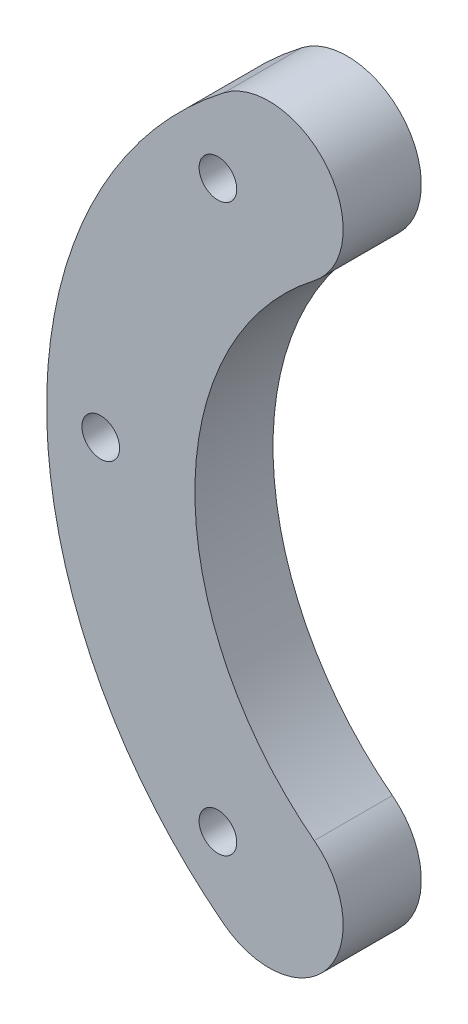
from build123d import *

# Parameters (mm, degrees)
SKETCH_1_R          = 48.25
SKETCH_1_R_2        = 32.5
SKETCH_1_R_3        = 2
EXTRUDE_1_DEPTH     = 8.3
CUT_EXTRUDE_START   = -46
SKETCH_2_R          = 2
CUT_EXTRUDE_1_DEPTH = 46


with BuildPart() as part:
    # 草图1 → 凸台-拉伸1 (new body)
    with BuildSketch(Plane.XY):
        Circle(SKETCH_1_R)
        Circle(SKETCH_1_R_2, mode=Mode.SUBTRACT)
        with Locations((0, 42.5)):
            Circle(SKETCH_1_R_3, mode=Mode.SUBTRACT)
        with Locations((30.0520382, 30.0520382)):
            Circle(SKETCH_1_R_3, mode=Mode.SUBTRACT)
        with Locations((42.5, 0)):
            Circle(SKETCH_1_R_3, mode=Mode.SUBTRACT)
        with Locations((30.0520382, -30.0520382)):
            Circle(SKETCH_1_R_3, mode=Mode.SUBTRACT)
        with Locations((0, -42.5)):
            Circle(SKETCH_1_R_3, mode=Mode.SUBTRACT)
        with Locations((-30.0520382, -30.0520382)):
            Circle(SKETCH_1_R_3, mode=Mode.SUBTRACT)
        with Locations((-42.5, 0)):
            Circle(SKETCH_1_R_3, mode=Mode.SUBTRACT)
        with Locations((-30.0520382, 30.0520382)):
            Circle(SKETCH_1_R_3, mode=Mode.SUBTRACT)
    extrude(amount=EXTRUDE_1_DEPTH)

    # 草图2 → 切除-拉伸1 (cut)
    # profile 1 of 2: a face of its own
    with BuildSketch(Plane.XY.offset(8.3).offset(CUT_EXTRUDE_START)):
        with BuildLine():
            ThreePointArc((40.5, 0), (42.5, 2), (44.5, 0))
            Line((44.5, 0), (48.25, 0))
            ThreePointArc((48.25, 0), (21.312594161, 43.287825426), (-29.421951508, 38.241486235))
            ThreePointArc((-29.421951508, 38.241486235), (-21.141442838, 39.065111353), (-16.744923335, 32))
            ThreePointArc((-16.744923335, 32), (-17.554811907, 28.521519654), (-19.817894894, 25.75851397))
            ThreePointArc((-19.817894894, 25.75851397), (14.355633318, 29.157602646), (32.5, 0))
            Line((32.5, 0), (40.5, 0))
        make_face()
        with Locations((0, 42.5)):
            Circle(SKETCH_2_R, mode=Mode.SUBTRACT)
        with Locations((30.0520382, 30.0520382)):
            Circle(SKETCH_2_R, mode=Mode.SUBTRACT)
    # profile 2 of 2: a face of its own
    with BuildSketch(Plane.XY.offset(8.3).offset(CUT_EXTRUDE_START)):
        with BuildLine():
            Line((48.25, 0), (44.5, 0))
            ThreePointArc((44.5, 0), (42.5, -2), (40.5, 0))
            Line((40.5, 0), (32.5, 0))
            ThreePointArc((32.5, 0), (14.355633349, -29.15760263), (-19.81789484, -25.758514012))
            ThreePointArc((-19.81789484, -25.758514012), (-17.554811892, -28.521519685), (-16.744923335, -32))
            ThreePointArc((-16.744923335, -32), (-21.14144309, -39.065111477), (-29.421951953, -38.241485892))
            ThreePointArc((-29.421951953, -38.241485892), (21.312593909, -43.28782555), (48.25, 0))
        make_face()
        with Locations((0, -42.5)):
            Circle(SKETCH_2_R, mode=Mode.SUBTRACT)
        with Locations((30.0520382, -30.0520382)):
            Circle(SKETCH_2_R, mode=Mode.SUBTRACT)
    extrude(amount=CUT_EXTRUDE_1_DEPTH, mode=Mode.SUBTRACT)


solid = part.part
